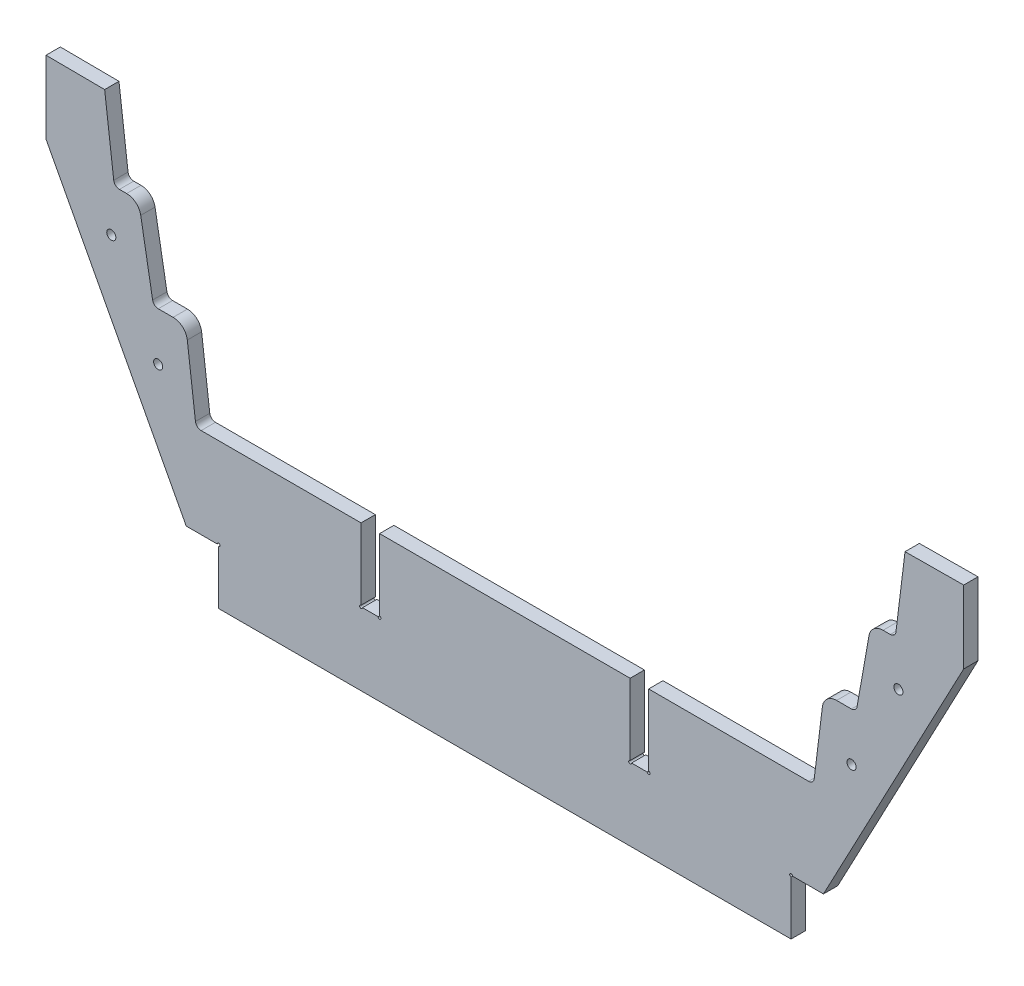
from build123d import *

# Parameters (mm, degrees)
SKETCH2_R            = 3.175
BOSS_EXTRUDE1_DEPTH  = 10
FILLET1_R            = 10
FILLET1_OF_MIRROR1_R = 10


with BuildPart() as part:
    # Sketch2 → Boss-Extrude1 (new body)
    with BuildSketch(Plane.XY):
        with BuildLine():
            Line((222.622994392, -300), (320.613470585, -114.844314923))
            Line((320.613470585, -114.844314923), (320.613470585, -64.044314923))
            Line((320.613470585, -64.044314923), (279.630331697, -64.339801211))
            Line((279.630331697, -64.339801211), (273.278578782, -116.070677374))
            ThreePointArc((273.278578782, -116.070677374), (271.958874368, -118.579022883), (269.308394175, -119.5832))
            Line((269.308394175, -119.5832), (255.875555496, -119.5832))
            Line((255.875555496, -119.5832), (246.112578717, -174.951792711))
            ThreePointArc((246.112578717, -174.951792711), (244.744498144, -177.321377772), (242.173347705, -178.2572))
            Line((242.173347705, -178.2572), (222.957537911, -178.2572))
            Line((222.957537911, -178.2572), (216.178322678, -233.469477374))
            ThreePointArc((216.178322678, -233.469477374), (214.858618264, -235.977822883), (212.208138071, -236.982))
            Line((212.208138071, -236.982), (100.477, -236.982))
            Line((100.477, -236.982), (100.477, -286.782))
            ThreePointArc((100.477, -286.782), (101.184106781, -288.489106781), (99.477, -287.782))
            Line((99.477, -287.782), (88.523, -287.782))
            ThreePointArc((88.523, -287.782), (86.815893219, -288.489106781), (87.523, -286.782))
            Line((87.523, -286.782), (87.523, -236.982))
            Line((87.523, -236.982), (0, -236.982))
            Line((0, -236.982), (0, -338.582))
            Line((0, -338.582), (200, -338.582))
            Line((200, -338.582), (200, -301))
            ThreePointArc((200, -301), (199.292893219, -299.292893219), (201, -300))
            Line((201, -300), (222.622994392, -300))
        make_face()
        with Locations((242.256504613, -211.869730158)):
            Circle(SKETCH2_R, mode=Mode.SUBTRACT)
        with Locations((275, -150)):
            Circle(SKETCH2_R, mode=Mode.SUBTRACT)
    boss_extrude1 = extrude(amount=BOSS_EXTRUDE1_DEPTH)

    # Fillet1
    fillet1_edges = [part.edges().sort_by_distance(p)[0] for p in [
        (222.957537911, -178.2572, 5),
        (255.875555496, -119.5832, 5),
    ]]
    fillet(fillet1_edges, radius=FILLET1_R)

    # Mirror1: Boss-Extrude1 across plane
    add(boss_extrude1.mirror(Plane(origin=(0, 0, 10), x_dir=(0, 0, 1), z_dir=(1, 0, 0))))

    # Fillet1 of Mirror1
    fillet1_of_mirror1_edges = [part.edges().sort_by_distance(p)[0] for p in [
        (-222.957537911, -178.2572, 5),
        (-255.875555496, -119.5832, 5),
    ]]
    fillet(fillet1_of_mirror1_edges, radius=FILLET1_OF_MIRROR1_R)


solid = part.part
